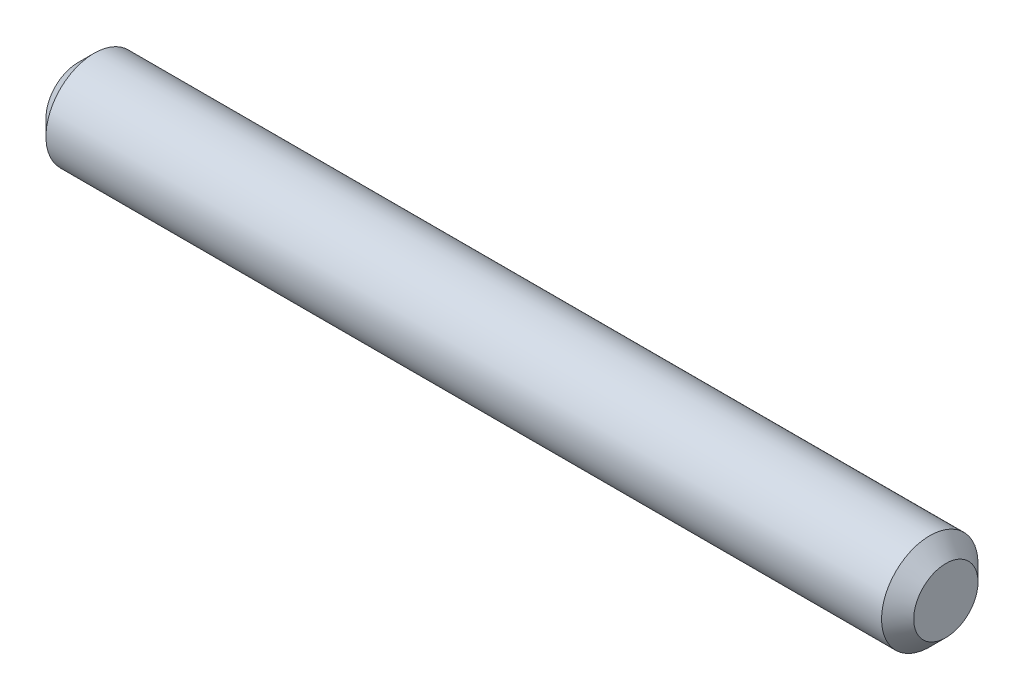
from build123d import *

# Parameters (mm, degrees)
SCHIZZO1_R                   = 3
ESTRUSIONE_ESTRUSIONE1_DEPTH = 54
SMUSSO1_SIZE                 = 1


with BuildPart() as part:
    # Schizzo1 → Estrusione-Estrusione1 (new body)
    with BuildSketch(Plane(origin=(0, 0, 0), x_dir=(0, 0, -1), z_dir=(1, 0, 0))):
        Circle(SCHIZZO1_R)
    extrude(amount=ESTRUSIONE_ESTRUSIONE1_DEPTH)

    # Smusso1
    smusso1_edges = [part.edges().sort_by_distance(p)[0] for p in [
        (0, 0, 3),
        (54, 0, 3),
    ]]
    chamfer(smusso1_edges, length=SMUSSO1_SIZE)


solid = part.part
